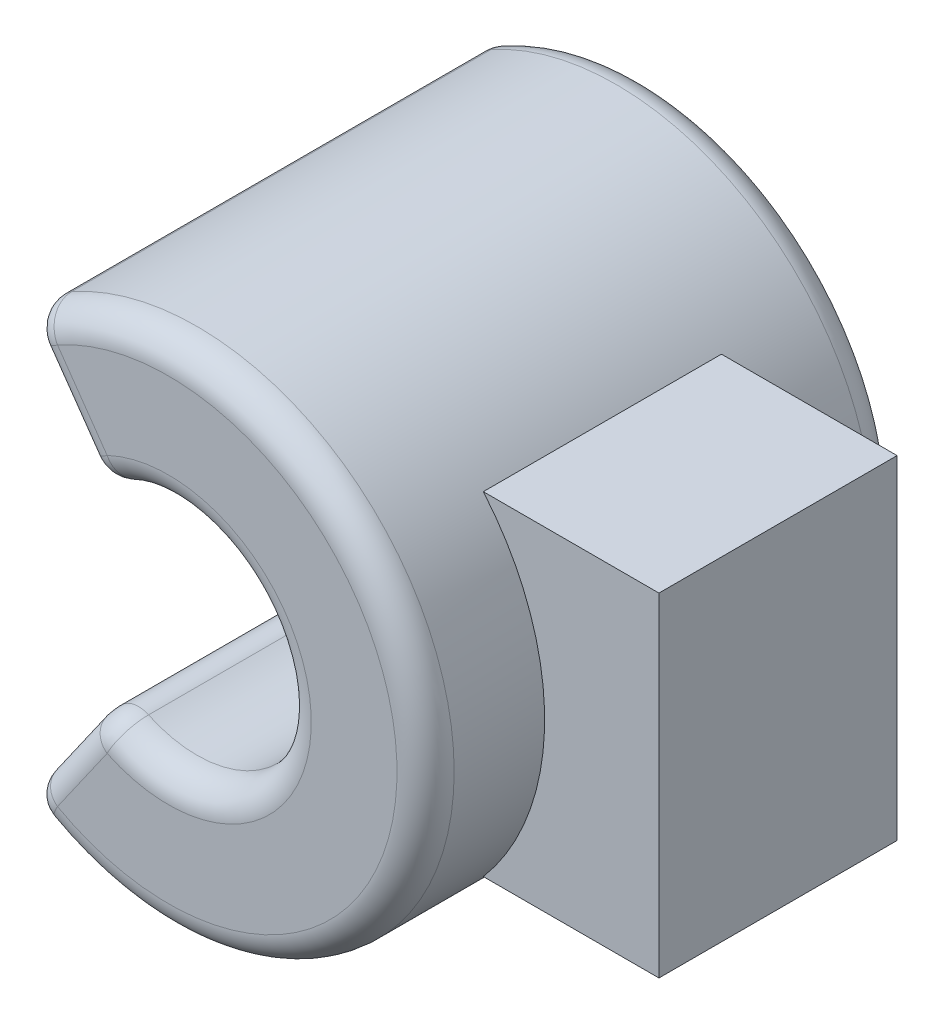
from build123d import *

# Parameters (mm, degrees)
EXTRUDE_THIN1_DEPTH = 5
FILLET1_R           = 0.6
FILLET2_R           = 0.5
BOSS_EXTRUDE1_START = 3.8
SKETCH2_W           = 5
SKETCH2_H           = 7
BOSS_EXTRUDE1_DEPTH = 4


with BuildPart() as part:
    # Sketch1 → Extrude-Thin1 (new, symmetric)
    with BuildSketch(Plane.XY):
        with BuildLine():
            ThreePointArc((-1.376583447, -1.965964906), (2.4, 0), (-1.376583447, 1.965964906))
            Line((-1.376583447, 1.965964906), (-3.097312756, 4.423421039))
            ThreePointArc((-3.097312756, 4.423421039), (5.4, 0), (-3.097312756, -4.423421039))
            Line((-3.097312756, -4.423421039), (-1.376583447, -1.965964906))
        make_face()
    extrude(amount=EXTRUDE_THIN1_DEPTH, both=True)

    # Fillet1
    fillet1_edges = [part.edges().sort_by_distance(p)[0] for p in [
        (2.4, 0, 5),
        (2.4, 0, -5),
        (5.4, 0, 5),
        (5.4, 0, -5),
    ]]
    fillet(fillet1_edges, radius=FILLET1_R)

    # Fillet2
    fillet2_edges = [part.edges().sort_by_distance(p)[0] for p in [
        (-2.236948102, -3.194692973, -5),
        (-2.236948102, 3.194692973, -5),
        (-1.376583447, 1.965964906, 0),
        (-2.236948102, 3.194692973, 5),
        (-3.097312756, 4.423421039, 0),
        (-2.996514767, 4.279466592, 4.824264069),
        (-2.996514767, 4.279466592, -4.824264069),
        (-1.477381436, 2.109919354, 4.824264069),
        (-1.477381436, 2.109919354, -4.824264069),
        (-1.376583447, -1.965964906, 0),
        (-3.097312756, -4.423421039, 0),
        (-2.236948102, -3.194692973, 5),
        (-2.996514767, -4.279466592, 4.824264069),
        (-2.996514767, -4.279466592, -4.824264069),
        (-1.477381436, -2.109919354, 4.824264069),
        (-1.477381436, -2.109919354, -4.824264069),
    ]]
    fillet(fillet2_edges, radius=FILLET2_R)

    # Sketch2 → Boss-Extrude1 (add)
    with BuildSketch(Plane(origin=(0, 0, 0), x_dir=(0, 0, -1), z_dir=(1, 0, 0)).offset(BOSS_EXTRUDE1_START)):
        Rectangle(SKETCH2_W, SKETCH2_H)
    extrude(amount=BOSS_EXTRUDE1_DEPTH)


solid = part.part
